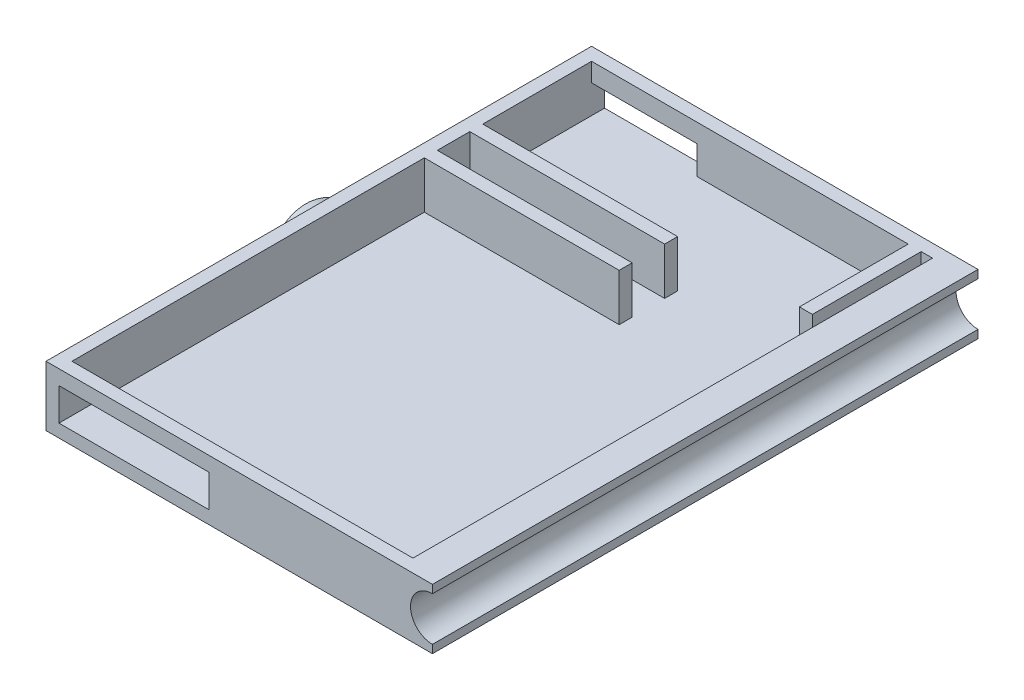
from build123d import *

# Parameters (mm, degrees)
SKETCH2_W            = 42
SKETCH2_H            = 64
BOSS_EXTRUDE1_DEPTH  = 1.6
SKETCH4_W            = 47.6
SKETCH4_H            = 67.2
SKETCH4_W_2          = 42
SKETCH4_H_2          = 64
BOSS_EXTRUDE2_DEPTH  = 6.6
BOSS_EXTRUDE3_DEPTH  = 1.6
CUT_EXTRUDE2_DEPTH   = 53.6
SKETCH12_W           = 18.5
SKETCH12_H           = 4
CUT_EXTRUDE5_DEPTH   = 4.5
SKETCH14_W           = 24
SKETCH14_H           = 7.2
BOSS_EXTRUDE6_DEPTH  = 5
SKETCH21_W           = 47.6
SKETCH21_H           = 67.2
BOSS_EXTRUDE8_DEPTH  = 0.8
SKETCH22_W           = 13
SKETCH22_H           = 3.5
CUT_EXTRUDE6_DEPTH   = 10.8
SKETCH26_W           = 24
SKETCH26_H           = 4
CUT_EXTRUDE7_DEPTH   = 5.8
SKETCH27_W           = 3
SKETCH27_H           = 13.4
BOSS_EXTRUDE9_DEPTH  = 5.8
SKETCH28_R           = 2.7
CUT_EXTRUDE8_DEPTH   = 70.8
SKETCH29_W           = 4
SKETCH29_H           = 3.7
BOSS_EXTRUDE10_DEPTH = 0.5
CUT_EXTRUDE9_DEPTH   = 4.5
CUT_EXTRUDE10_DEPTH  = 4.5
SKETCH38_W           = 1.4
SKETCH38_H           = 13.4
CUT_EXTRUDE12_DEPTH  = 5.8


with BuildPart() as part:
    # Sketch2 → Boss-Extrude1 (new body)
    with BuildSketch(Plane(origin=(0, 0, 0), x_dir=(1, 0, 0), z_dir=(0, 1, 0))):
        with Locations((21, -32)):
            Rectangle(SKETCH2_W, SKETCH2_H)
    extrude(amount=BOSS_EXTRUDE1_DEPTH)

    # Sketch4 → Boss-Extrude2 (add)
    with BuildSketch(Plane(origin=(0, 0, 0), x_dir=(1, 0, 0), z_dir=(0, 1, 0))):
        with Locations((22.2, -32)):
            Rectangle(SKETCH4_W, SKETCH4_H)
        with Locations((21, -32)):
            Rectangle(SKETCH4_W_2, SKETCH4_H_2, mode=Mode.SUBTRACT)
    extrude(amount=BOSS_EXTRUDE2_DEPTH)

    # Sketch6 → Boss-Extrude3 (add)
    with BuildSketch(Plane.ZY.offset(1.6)):
        with BuildLine():
            Line((25.4, 0), (38.6, 0))
            ThreePointArc((38.6, 0), (32, 6.6), (25.4, 0))
        make_face()
    extrude(amount=BOSS_EXTRUDE3_DEPTH)

    # Sketch7 → Cut-Extrude2 (cut)
    with BuildSketch(Plane.XY):
        Polygon((-3.2, 6.6), (-3.2, 4.95), (-2.7, 4.95), align=None)
        Polygon((-3.2, 4.95), (-3.2, 3.3), (-2.7, 3.3), align=None)
        Polygon((-2.7, 1.65), (-3.2, 3.3), (-3.2, 1.65), align=None)
        Polygon((-2.7, 0), (-3.2, 1.65), (-3.2, 0), align=None)
    extrude(amount=CUT_EXTRUDE2_DEPTH, mode=Mode.SUBTRACT)

    # Sketch12 → Cut-Extrude5 (cut)
    with BuildSketch(Plane(origin=(0, 0, 64), x_dir=(-1, 0, 0), z_dir=(0, 0, -1))):
        with Locations((-9.25, 3.6)):
            Rectangle(SKETCH12_W, SKETCH12_H)
    extrude(amount=-CUT_EXTRUDE5_DEPTH, mode=Mode.SUBTRACT)

    # Sketch14 → Boss-Extrude6 (add)
    with BuildSketch(Plane(origin=(0, 1.6, 0), x_dir=(1, 0, 0), z_dir=(0, 1, 0))):
        with Locations((12, -17)):
            Rectangle(SKETCH14_W, SKETCH14_H)
    extrude(amount=BOSS_EXTRUDE6_DEPTH)

    # Sketch21 → Boss-Extrude8 (add)
    with BuildSketch(Plane(origin=(0, 6.6, 0), x_dir=(1, 0, 0), z_dir=(0, 1, 0))):
        with Locations((22.2, -32)):
            Rectangle(SKETCH21_W, SKETCH21_H)
        Polygon((0, -13.4), (0, 0), (42, 0), (42, -64), (0, -64), (0, -20.6), (24, -20.6), (24, -13.4), align=None, mode=Mode.SUBTRACT)
    extrude(amount=BOSS_EXTRUDE8_DEPTH)

    # Sketch22 → Cut-Extrude6 (cut)
    with BuildSketch(Plane.XY):
        with Locations((6.5, 3.35)):
            Rectangle(SKETCH22_W, SKETCH22_H)
    extrude(amount=-CUT_EXTRUDE6_DEPTH, mode=Mode.SUBTRACT)

    # Sketch26 → Cut-Extrude7 (cut)
    with BuildSketch(Plane(origin=(0, 7.4, 0), x_dir=(1, 0, 0), z_dir=(0, 1, 0))):
        with Locations((12, -17)):
            Rectangle(SKETCH26_W, SKETCH26_H)
    extrude(amount=-CUT_EXTRUDE7_DEPTH, mode=Mode.SUBTRACT)

    # Sketch27 → Boss-Extrude9 (add)
    with BuildSketch(Plane(origin=(0, 1.6, 0), x_dir=(1, 0, 0), z_dir=(0, 1, 0))):
        with Locations((40.5, -6.7)):
            Rectangle(SKETCH27_W, SKETCH27_H)
    extrude(amount=BOSS_EXTRUDE9_DEPTH)

    # Sketch28 → Cut-Extrude8 (cut)
    with BuildSketch(Plane.XY.offset(65.6)):
        with Locations((46, 3.7)):
            Circle(SKETCH28_R)
    extrude(amount=-CUT_EXTRUDE8_DEPTH, mode=Mode.SUBTRACT)

    # Sketch29 → Boss-Extrude10 (add)
    with BuildSketch(Plane.ZY.offset(1.6)):
        with Locations((23.4, 5.55)):
            Rectangle(SKETCH29_W, SKETCH29_H)
        with Locations((40.6, 5.55)):
            Rectangle(SKETCH29_W, SKETCH29_H)
    extrude(amount=BOSS_EXTRUDE10_DEPTH)

    # Sketch30 → Cut-Extrude9 (cut)
    with BuildSketch(Plane(origin=(0, 0, 21.4), x_dir=(-1, 0, 0), z_dir=(0, 0, -1))):
        Polygon((2.1, 4.625), (2.1, 5.55), (2.1, 7.4), (1.6, 7.4), align=None)
        Polygon((2.1, 3.7), (2.1, 4.625), (1.6, 3.7), align=None)
    extrude(amount=-CUT_EXTRUDE9_DEPTH, mode=Mode.SUBTRACT)

    # Sketch31 → Cut-Extrude10 (cut)
    with BuildSketch(Plane.XY.offset(42.6)):
        Polygon((-2.1, 5.55), (-2.1, 4.625), (-1.6, 7.4), (-2.1, 7.4), align=None)
        Polygon((-2.1, 4.625), (-2.1, 3.7), (-1.6, 3.7), align=None)
    extrude(amount=-CUT_EXTRUDE10_DEPTH, mode=Mode.SUBTRACT)

    # Sketch38 → Cut-Extrude12 (cut)
    with BuildSketch(Plane(origin=(0, 7.4, 0), x_dir=(1, 0, 0), z_dir=(0, 1, 0))):
        with Locations((41.3, -6.7)):
            Rectangle(SKETCH38_W, SKETCH38_H)
    extrude(amount=-CUT_EXTRUDE12_DEPTH, mode=Mode.SUBTRACT)


solid = part.part
